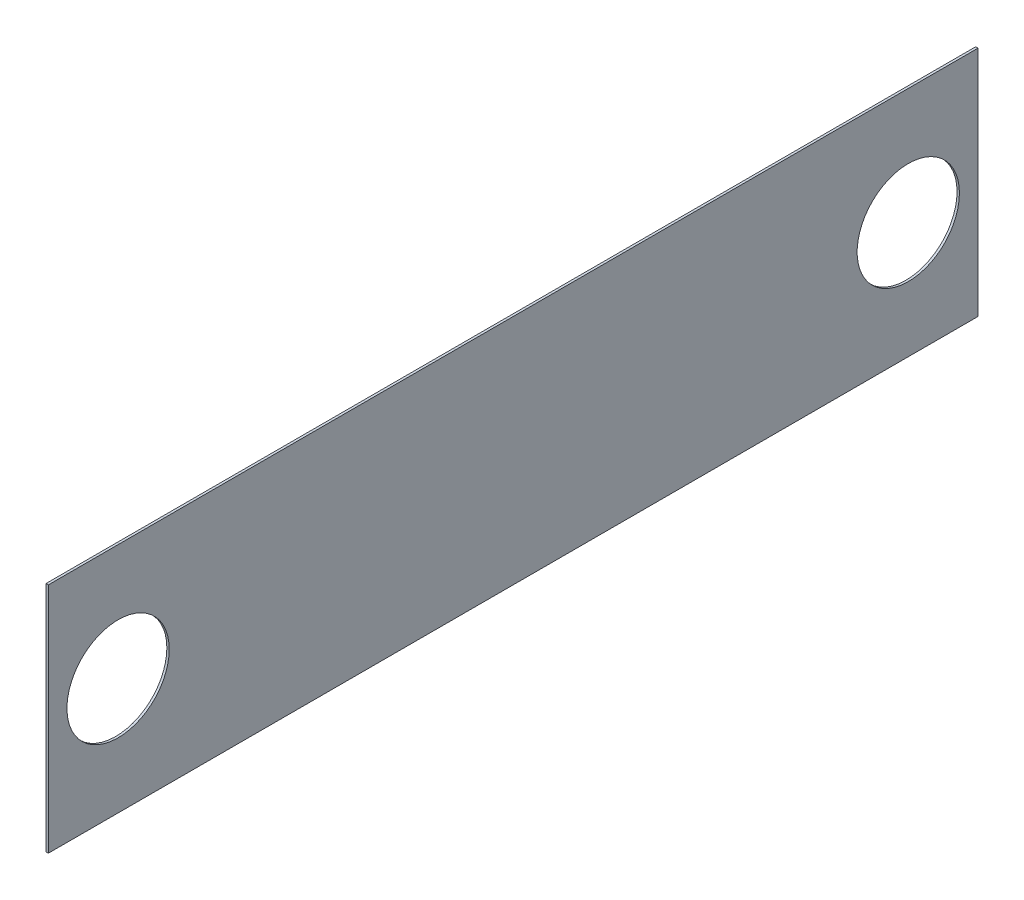
from build123d import *

# Parameters (mm, degrees)
SKETCH1_W             = 100
SKETCH1_H             = 25
BOSS_EXTRUDE1_DEPTH   = 0.254
M10_CLEARANCE_HOLE1_D = 11


with BuildPart() as part:
    # Sketch1 → Boss-Extrude1 (new body)
    with BuildSketch(Plane(origin=(0, 0, 0), x_dir=(0, 0, -1), z_dir=(1, 0, 0))):
        Rectangle(SKETCH1_W, SKETCH1_H)
    extrude(amount=BOSS_EXTRUDE1_DEPTH)

    # M10 Clearance Hole1 (through all)
    with Locations(Plane(origin=(0.254, 0, 0), x_dir=(0, 0, -1), z_dir=(1, 0, 0))):
        with Locations((-42.5, 0), (42.5, 0)):
            Hole(M10_CLEARANCE_HOLE1_D / 2)


solid = part.part
